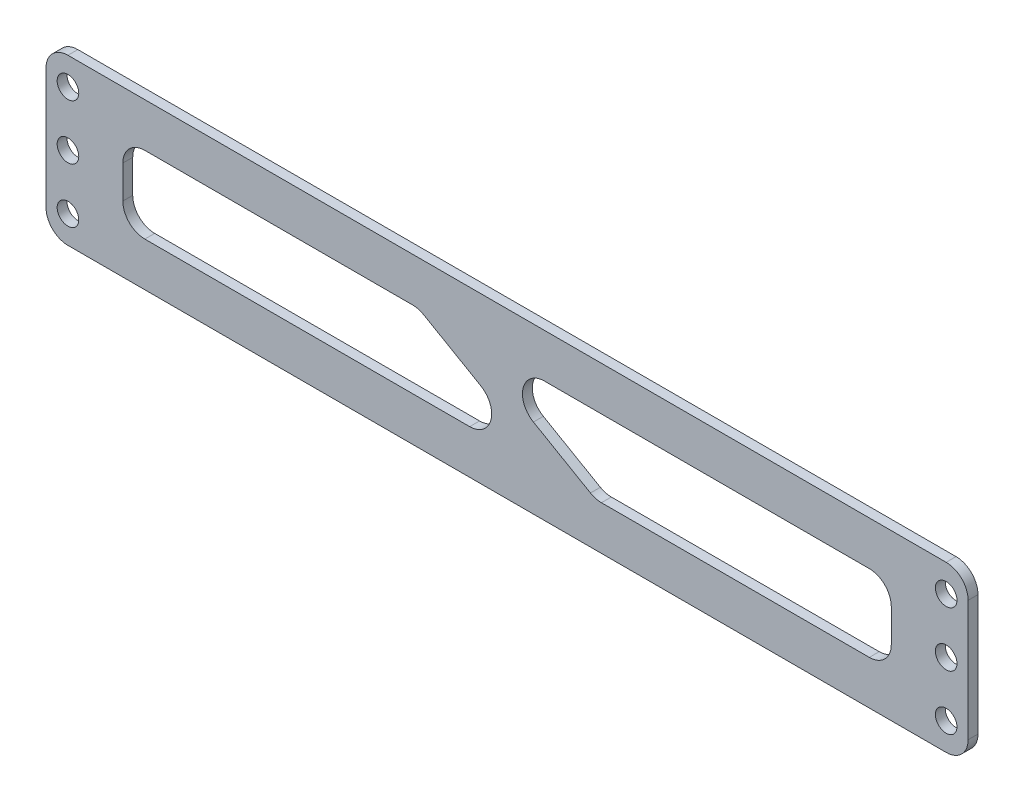
from build123d import *

# Parameters (mm, degrees)
SKETCH1_R           = 2.5
BOSS_EXTRUDE1_DEPTH = 2.286
CUT_EXTRUDE1_DEPTH  = 823.59169598
FILLET1_R           = 5.08


with BuildPart() as part:
    # Sketch1 → Boss-Extrude1 (new body)
    with BuildSketch(Plane.XY):
        with BuildLine():
            Line((-7.62, 755.65), (210.82, 755.65))
            ThreePointArc((210.82, 755.65), (214.412102448, 757.137897552), (215.9, 760.73))
            Line((215.9, 760.73), (215.9, 788.67))
            ThreePointArc((215.9, 788.67), (214.412102448, 792.262102448), (210.82, 793.75))
            Line((210.82, 793.75), (-7.62, 793.75))
            ThreePointArc((-7.62, 793.75), (-11.212102448, 792.262102448), (-12.7, 788.67))
            Line((-12.7, 788.67), (-12.7, 760.73))
            ThreePointArc((-12.7, 760.73), (-11.212102448, 757.137897552), (-7.62, 755.65))
        make_face()
        with Locations((0, 762)):
            Circle(SKETCH1_R, mode=Mode.SUBTRACT)
        with Locations((0, 774.7)):
            Circle(SKETCH1_R, mode=Mode.SUBTRACT)
        with Locations((0, 787.4)):
            Circle(SKETCH1_R, mode=Mode.SUBTRACT)
        with Locations((203.2, 762)):
            Circle(SKETCH1_R, mode=Mode.SUBTRACT)
        with Locations((203.2, 774.7)):
            Circle(SKETCH1_R, mode=Mode.SUBTRACT)
        with Locations((203.2, 787.4)):
            Circle(SKETCH1_R, mode=Mode.SUBTRACT)
        with BuildLine():
            Line((17.78, 783.59), (79.760886363, 783.59))
            ThreePointArc((79.760886363, 783.59), (81.075687113, 783.416903198), (82.300886363, 782.909409051))
            Line((82.300886363, 782.909409051), (95.499113517, 775.289409051))
            ThreePointArc((95.499113517, 775.289409051), (97.866016715, 769.575199251), (92.959113517, 765.81))
            Line((92.959113517, 765.81), (17.78, 765.81))
            ThreePointArc((17.78, 765.81), (14.187897552, 767.297897552), (12.7, 770.89))
            Line((12.7, 770.89), (12.7, 778.51))
            ThreePointArc((12.7, 778.51), (14.187897552, 782.102102448), (17.78, 783.59))
        make_face(mode=Mode.SUBTRACT)
        with BuildLine():
            Line((190.5, 778.51), (190.5, 770.89))
            ThreePointArc((190.5, 770.89), (189.012102448, 767.297897552), (185.42, 765.81))
            Line((185.42, 765.81), (123.439113517, 765.81))
            ThreePointArc((123.439113517, 765.81), (122.124312768, 765.983096802), (120.899113517, 766.490590949))
            Line((120.899113517, 766.490590949), (107.700886363, 774.110590949))
            ThreePointArc((107.700886363, 774.110590949), (105.333983166, 779.824800749), (110.240886363, 783.59))
            Line((110.240886363, 783.59), (185.42, 783.59))
            ThreePointArc((185.42, 783.59), (189.012102448, 782.102102448), (190.5, 778.51))
        make_face(mode=Mode.SUBTRACT)
    extrude(amount=BOSS_EXTRUDE1_DEPTH)

    # Sketch3 → Cut-Extrude1 (cut, through all)
    with BuildSketch(Plane(origin=(0, 0, 0), x_dir=(-1, 0, 0), z_dir=(0, 0, -1))):
        with BuildLine():
            Line((-210.82, 755.65), (-208.28, 755.65))
            Line((-208.28, 755.65), (-208.28, 793.75))
            Line((-208.28, 793.75), (-210.82, 793.75))
            ThreePointArc((-210.82, 793.75), (-214.412102448, 792.262102448), (-215.9, 788.67))
            Line((-215.9, 788.67), (-215.9, 760.73))
            ThreePointArc((-215.9, 760.73), (-214.412102448, 757.137897552), (-210.82, 755.65))
        make_face()
        with BuildLine():
            Line((5.08, 793.75), (5.08, 755.65))
            Line((5.08, 755.65), (7.62, 755.65))
            ThreePointArc((7.62, 755.65), (11.212102448, 757.137897552), (12.7, 760.73))
            Line((12.7, 760.73), (12.7, 788.67))
            ThreePointArc((12.7, 788.67), (11.212102448, 792.262102448), (7.62, 793.75))
            Line((7.62, 793.75), (5.08, 793.75))
        make_face()
    extrude(amount=-CUT_EXTRUDE1_DEPTH, mode=Mode.SUBTRACT)

    # Fillet1
    fillet1_edges = [part.edges().sort_by_distance(p)[0] for p in [
        (208.28, 755.65, 1.143),
        (208.28, 793.75, 1.143),
        (-5.08, 755.65, 1.143),
        (-5.08, 793.75, 1.143),
    ]]
    fillet(fillet1_edges, radius=FILLET1_R)


solid = part.part
